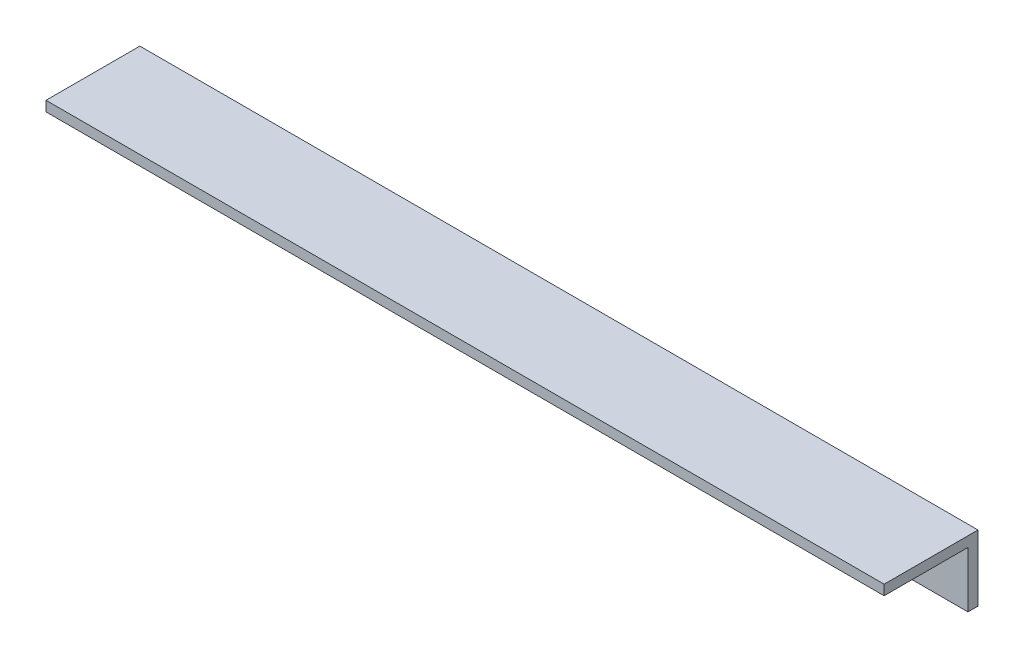
from build123d import *

# Parameters (mm, degrees)
AUFSATZ_LINEAR_AUSTRAGEN1_DEPTH = 1500


with BuildPart() as part:
    # Skizze1 → Aufsatz-Linear austragen1 (new body)
    with BuildSketch(Plane(origin=(0, 0, 0), x_dir=(0, 0, -1), z_dir=(1, 0, 0))):
        Polygon((0, 0), (0, 100), (-150, 100), (-150, 118), (18, 118), (18, 0), align=None)
    extrude(amount=AUFSATZ_LINEAR_AUSTRAGEN1_DEPTH)


solid = part.part
